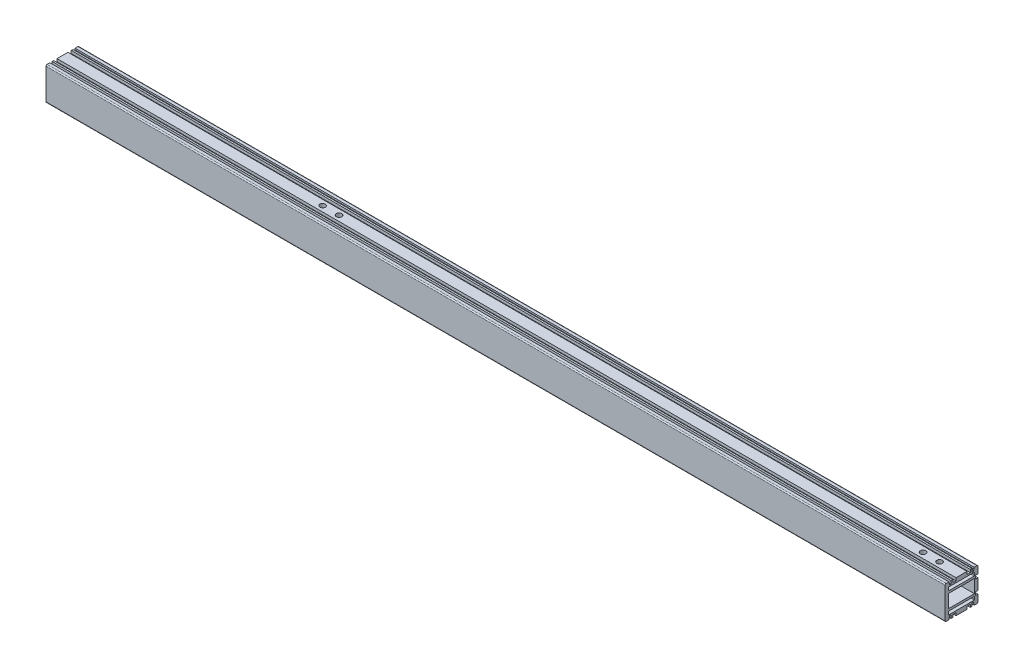
from build123d import *

# Parameters (mm, degrees)
SKETCH_1_W             = 23.5
SKETCH_1_H             = 12
EXTRUDE_1_DEPTH        = 409.5
HOLE_WIZARD_M6_1_D     = 5
HOLE_WIZARD_M6_1_DEPTH = 15
HOLE_WIZARD_M6_1_TIP   = 1.502151548
HOLE_WIZARD_M6_2_D     = 5
HOLE_WIZARD_M6_2_DEPTH = 15
HOLE_WIZARD_M6_2_TIP   = 1.502151548
HOLE_WIZARD_M6_3_D     = 5
HOLE_WIZARD_M6_3_DEPTH = 15
HOLE_WIZARD_M6_3_TIP   = 1.502151548


with BuildPart() as part:
    # 草图1 → 凸台-拉伸1 (new, symmetric)
    with BuildSketch(Plane(origin=(0, 0, 0), x_dir=(0, 0, -1), z_dir=(1, 0, 0))):
        with BuildLine():
            Line((-14, 15), (-11.5, 15))
            Line((-11.5, 15), (-11.5, 13.5))
            Line((-11.5, 13.5), (-11.4, 13.5))
            ThreePointArc((-11.4, 13.5), (-11.117157288, 13.382842712), (-11, 13.1))
            Line((-11, 13.1), (-11, 12))
            Line((-11, 12), (-9.5, 12))
            Line((-9.5, 12), (-9.5, 15))
            Line((-9.5, 15), (-8, 15))
            Line((-8, 15), (-8, 12.5))
            Line((-8, 12.5), (-5, 12.5))
            Line((-5, 12.5), (-5, 15))
            Line((-5, 15), (5, 15))
            Line((5, 15), (5, 12.5))
            Line((5, 12.5), (8, 12.5))
            Line((8, 12.5), (8, 15))
            Line((8, 15), (9.5, 15))
            Line((9.5, 15), (9.5, 12))
            Line((9.5, 12), (11, 12))
            Line((11, 12), (11, 13.1))
            ThreePointArc((11, 13.1), (11.117157288, 13.382842712), (11.4, 13.5))
            Line((11.4, 13.5), (11.5, 13.5))
            Line((11.5, 13.5), (11.5, 15))
            Line((11.5, 15), (14, 15))
            ThreePointArc((14, 15), (14.707106781, 14.707106781), (15, 14))
            Line((15, 14), (15, 8))
            Line((15, 8), (12.5, 8))
            Line((12.5, 8), (12.5, 5))
            Line((12.5, 5), (15, 5))
            Line((15, 5), (15, -5))
            Line((15, -5), (12.5, -5))
            Line((12.5, -5), (12.5, -8))
            Line((12.5, -8), (15, -8))
            Line((15, -8), (15, -14))
            ThreePointArc((15, -14), (14.707106781, -14.707106781), (14, -15))
            Line((14, -15), (11.5, -15))
            Line((11.5, -15), (11.5, -13.5))
            Line((11.5, -13.5), (11.4, -13.5))
            ThreePointArc((11.4, -13.5), (11.117157288, -13.382842712), (11, -13.1))
            Line((11, -13.1), (11, -12))
            Line((11, -12), (9.5, -12))
            Line((9.5, -12), (9.5, -15))
            Line((9.5, -15), (8, -15))
            Line((8, -15), (8, -12.5))
            Line((8, -12.5), (5, -12.5))
            Line((5, -12.5), (5, -15))
            Line((5, -15), (-5, -15))
            Line((-5, -15), (-5, -12.5))
            Line((-5, -12.5), (-8, -12.5))
            Line((-8, -12.5), (-8, -15))
            Line((-8, -15), (-9.5, -15))
            Line((-9.5, -15), (-9.5, -12))
            Line((-9.5, -12), (-11, -12))
            Line((-11, -12), (-11, -13.1))
            ThreePointArc((-11, -13.1), (-11.117157288, -13.382842712), (-11.4, -13.5))
            Line((-11.4, -13.5), (-11.5, -13.5))
            Line((-11.5, -13.5), (-11.5, -15))
            Line((-11.5, -15), (-14, -15))
            ThreePointArc((-14, -15), (-14.707106781, -14.707106781), (-15, -14))
            Line((-15, -14), (-15, 14))
            ThreePointArc((-15, 14), (-14.707106781, 14.707106781), (-14, 15))
        make_face()
        with BuildLine():
            Line((12, -10.5), (12, -8.5))
            ThreePointArc((12, -8.5), (11.853553391, -8.146446609), (11.5, -8))
            Line((11.5, -8), (-11.5, -8))
            ThreePointArc((-11.5, -8), (-11.853553391, -8.146446609), (-12, -8.5))
            Line((-12, -8.5), (-12, -10.5))
            ThreePointArc((-12, -10.5), (-11.853553391, -10.853553391), (-11.5, -11))
            Line((-11.5, -11), (11.5, -11))
            ThreePointArc((11.5, -11), (11.853553391, -10.853553391), (12, -10.5))
        make_face(mode=Mode.SUBTRACT)
        with BuildLine():
            Line((-11.5, 11), (11.5, 11))
            ThreePointArc((11.5, 11), (11.853553391, 10.853553391), (12, 10.5))
            Line((12, 10.5), (12, 8.5))
            ThreePointArc((12, 8.5), (11.853553391, 8.146446609), (11.5, 8))
            Line((11.5, 8), (-11.5, 8))
            ThreePointArc((-11.5, 8), (-11.853553391, 8.146446609), (-12, 8.5))
            Line((-12, 8.5), (-12, 10.5))
            ThreePointArc((-12, 10.5), (-11.853553391, 10.853553391), (-11.5, 11))
        make_face(mode=Mode.SUBTRACT)
        Rectangle(SKETCH_1_W, SKETCH_1_H, mode=Mode.SUBTRACT)
    extrude(amount=EXTRUDE_1_DEPTH, both=True)

    # M6 螺纹孔1
    with Locations(Plane.XZ.offset(15)):
        with Locations((389.5, 0), (374.5, 0), (-192.5, 0), (-207.5, 0), (-277.5, 0), (-292.5, 0), (-374.5, 0), (-389.5, 0)):
            Hole(HOLE_WIZARD_M6_1_D / 2, depth=HOLE_WIZARD_M6_1_DEPTH)
            with Locations((0, 0, -(HOLE_WIZARD_M6_1_DEPTH + HOLE_WIZARD_M6_1_TIP / 2))):  # 118° drill point
                Cone(0, HOLE_WIZARD_M6_1_D / 2, HOLE_WIZARD_M6_1_TIP, mode=Mode.SUBTRACT)

    # M6 螺纹孔2
    with Locations(Plane(origin=(0, 0, -15), x_dir=(-1, 0, 0), z_dir=(0, 0, -1))):
        with Locations((389.5, 0), (374.5, 0), (292.5, 0), (277.5, 0), (207.5, 0), (192.5, 0)):
            Hole(HOLE_WIZARD_M6_2_D / 2, depth=HOLE_WIZARD_M6_2_DEPTH)
            with Locations((0, 0, -(HOLE_WIZARD_M6_2_DEPTH + HOLE_WIZARD_M6_2_TIP / 2))):  # 118° drill point
                Cone(0, HOLE_WIZARD_M6_2_D / 2, HOLE_WIZARD_M6_2_TIP, mode=Mode.SUBTRACT)

    # M6 螺纹孔3
    with Locations(Plane(origin=(0, 15, 0), x_dir=(-1, 0, 0), z_dir=(0, 1, 0))):
        with Locations((172.5, 0), (157.5, 0), (-374.5, 0), (-389.5, 0)):
            Hole(HOLE_WIZARD_M6_3_D / 2, depth=HOLE_WIZARD_M6_3_DEPTH)
            with Locations((0, 0, -(HOLE_WIZARD_M6_3_DEPTH + HOLE_WIZARD_M6_3_TIP / 2))):  # 118° drill point
                Cone(0, HOLE_WIZARD_M6_3_D / 2, HOLE_WIZARD_M6_3_TIP, mode=Mode.SUBTRACT)


solid = part.part
